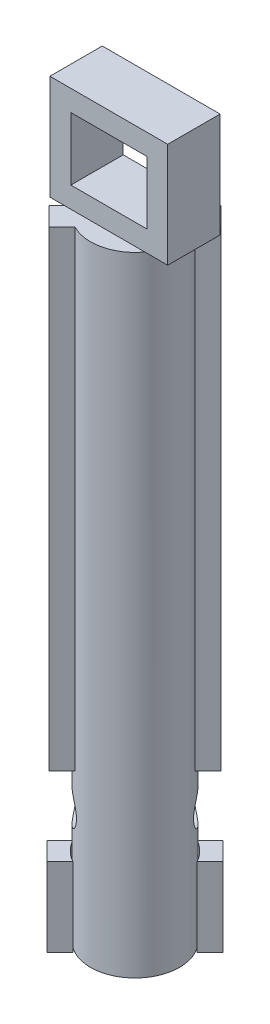
from build123d import *

# Parameters (mm, degrees)
SKETCH1_R             = 1.7
MAIN_BODY_DEPTH       = 12
TOP_GUIDES_DEPTH      = 18
BOTTOM_GUIDES_DEPTH   = 3
BOTTOM_GUIDES_2_DEPTH = 3
SKETCH10_W            = 4.5
SKETCH10_H            = 2
HOLE_EXTRUDE_DEPTH    = 4
SKETCH11_W            = 1.45
SKETCH11_H            = 2.4
HOLE_CUT_DEPTH        = 17.439889772
SKETCH12_W            = 0.625
SKETCH12_H            = 5.328201779


with BuildPart() as part:
    # Sketch1 → main body (new, symmetric)
    with BuildSketch(Plane(origin=(0, 0, 0), x_dir=(1, 0, 0), z_dir=(0, 1, 0))):
        with Locations(Location((0, 0, 0), (0, 0, 270))):
            Circle(SKETCH1_R)
    extrude(amount=MAIN_BODY_DEPTH, both=True)

    # Sketch2 → top guides (add)
    with BuildSketch(Plane(origin=(0, 12, 0), x_dir=(1, 0, 0), z_dir=(0, 1, 0))):
        with BuildLine():
            Line((-0.795359139, -1.50246592), (-1.290333886, -1.997440667))
            Line((-1.290333886, -1.997440667), (-1.997440667, -1.290333886))
            Line((-1.997440667, -1.290333886), (-1.50246592, -0.795359139))
            ThreePointArc((-1.50246592, -0.795359139), (-1.202081528, -1.202081528), (-0.795359139, -1.50246592))
        make_face()
        with BuildLine():
            Line((1.290333886, 1.997440667), (0.795359139, 1.50246592))
            ThreePointArc((0.795359139, 1.50246592), (1.202081528, 1.202081528), (1.50246592, 0.795359139))
            Line((1.50246592, 0.795359139), (1.997440667, 1.290333886))
            Line((1.997440667, 1.290333886), (1.290333886, 1.997440667))
        make_face()
    extrude(amount=-TOP_GUIDES_DEPTH)

    # Sketch10 → hole extrude (add)
    with BuildSketch(Plane(origin=(0, 12, 0), x_dir=(1, 0, 0), z_dir=(0, 1, 0))):
        Rectangle(SKETCH10_W, SKETCH10_H)
    extrude(amount=HOLE_EXTRUDE_DEPTH)

    # Sketch11 → hole cut (cut, through all)
    with BuildSketch(Plane.XY.offset(-1)):
        with Locations((0.725, 14)):
            Rectangle(SKETCH11_W, SKETCH11_H)
        with Locations((-0.725, 14)):
            Rectangle(SKETCH11_W, SKETCH11_H)
    extrude(amount=HOLE_CUT_DEPTH, mode=Mode.SUBTRACT)

    # Sketch12 → M1.6 Tapped Hole4 (revolve, cut)
    with BuildSketch(Plane(origin=(-1.643887276, -7.5, 1.643887276), x_dir=(0.7071067811865568, 0, 0.7071067811865384), z_dir=(0, 1, 0))):
        with Locations((0.3125, 2.66410089)):
            Rectangle(SKETCH12_W, SKETCH12_H)
    revolve(axis=Axis((-6.134015337, -7.5, 6.134015337), (0.7071067811865384, 0, -0.7071067811865568)), mode=Mode.SUBTRACT)


with BuildPart() as body_2:
    # Sketch7 → bottom guides (new body)
    with BuildSketch(Plane.XZ.offset(12)):
        with BuildLine():
            Line((1.539407513, -0.832300732), (2.03438226, -1.327275479))
            Line((2.03438226, -1.327275479), (1.327275479, -2.03438226))
            Line((1.327275479, -2.03438226), (0.832300732, -1.539407513))
            ThreePointArc((0.832300732, -1.539407513), (1.237436867, -1.237436867), (1.539407513, -0.832300732))
        make_face()
    extrude(amount=-BOTTOM_GUIDES_DEPTH)


with BuildPart() as body_3:
    # Sketch7 → bottom guides 2 (new body)
    with BuildSketch(Plane.XZ.offset(12)):
        with BuildLine():
            Line((-2.03438226, 1.327275479), (-1.539407513, 0.832300732))
            ThreePointArc((-1.539407513, 0.832300732), (-1.237436867, 1.237436867), (-0.832300732, 1.539407513))
            Line((-0.832300732, 1.539407513), (-1.327275479, 2.03438226))
            Line((-1.327275479, 2.03438226), (-2.03438226, 1.327275479))
        make_face()
    extrude(amount=-BOTTOM_GUIDES_2_DEPTH)


solid = Compound([part.part, body_2.part, body_3.part])
